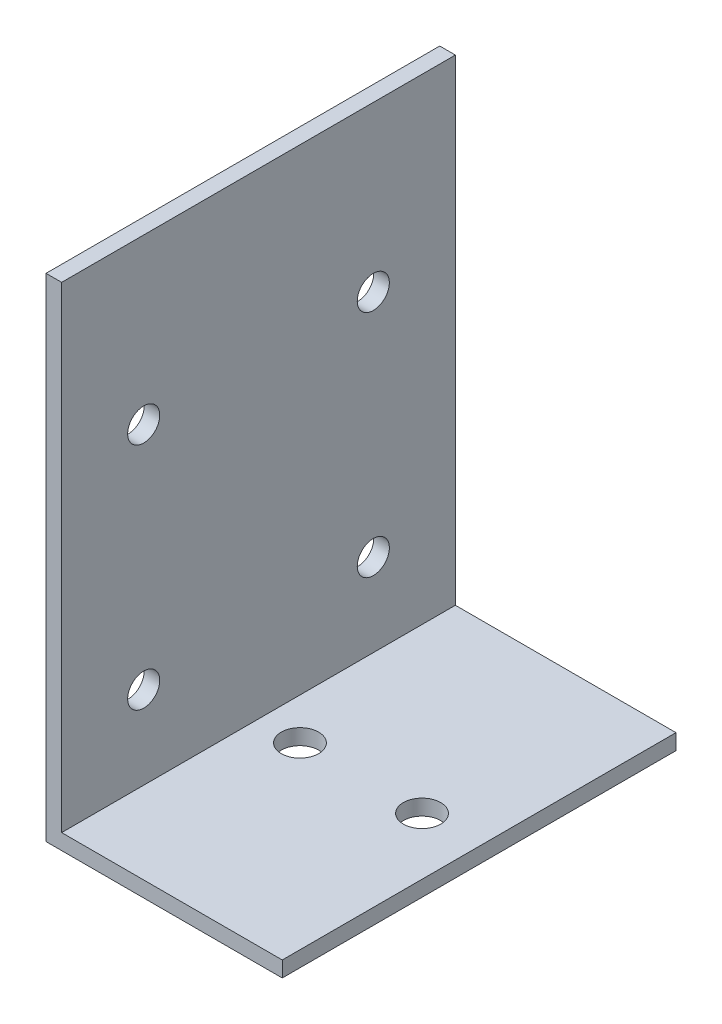
from build123d import *

# Parameters (mm, degrees)
BOSS_EXTRUDE1_DEPTH   = 20
F_4_CLEARANCE_HOLE1_D = 3.2639
F_6_CLEARANCE_HOLE1_D = 3.7973


with BuildPart() as part:
    # Sketch1 → Boss-Extrude1 (new body)
    with BuildSketch(Plane.XY):
        Polygon((0, 50), (0, 0), (24, 0), (24, 1.5875), (1.5875, 1.5875), (1.5875, 50), align=None)
    boss_extrude1 = extrude(amount=BOSS_EXTRUDE1_DEPTH)

    # #4 Clearance Hole1 (through all)
    with Locations(Plane.ZY):
        with Locations((11.6625, 33.325), (11.6625, 10)):
            f_4_clearance_hole1 = Hole(F_4_CLEARANCE_HOLE1_D / 2)

    # Mirror1: Boss-Extrude1, #4 Clearance Hole1 across plane
    add(boss_extrude1.mirror(Plane(origin=(0, 0, 0), x_dir=(1, 0, 0), z_dir=(0, 0, -1))))
    add(f_4_clearance_hole1.mirror(Plane(origin=(0, 0, 0), x_dir=(1, 0, 0), z_dir=(0, 0, -1))), mode=Mode.SUBTRACT)

    # #6 Clearance Hole1 (through all)
    with Locations(Plane(origin=(0, 0, 0), x_dir=(-1, 0, 0), z_dir=(0, -1, 0))):
        with Locations((-18.2, 0), (-5.8, 0)):
            Hole(F_6_CLEARANCE_HOLE1_D / 2)


solid = part.part
